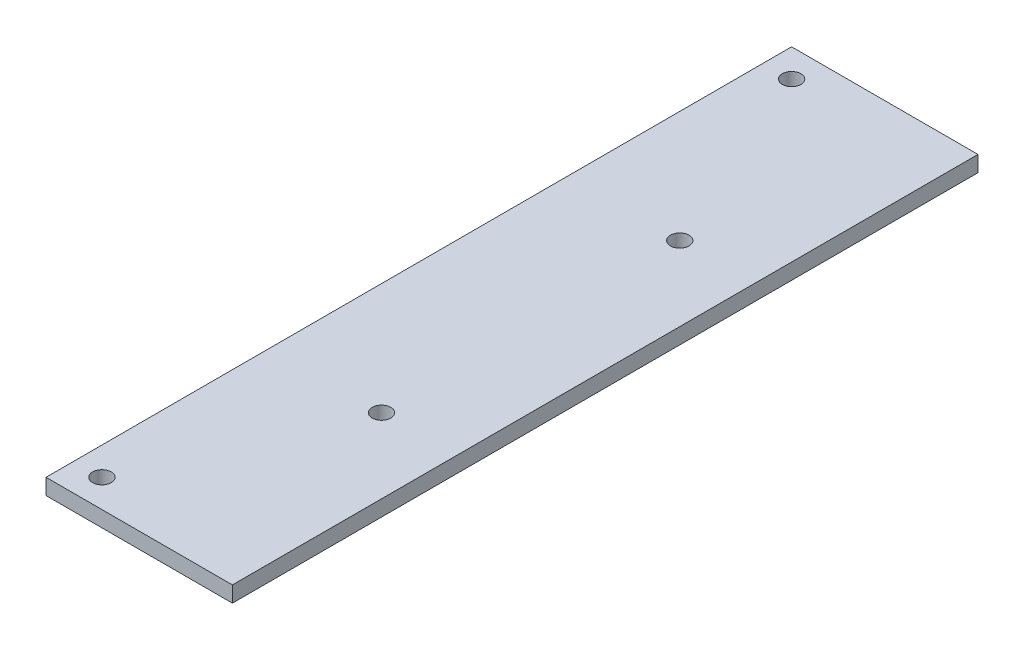
from build123d import *

# Parameters (mm, degrees)
SKETCH_1_W      = 20
SKETCH_1_H      = 80
SKETCH_1_R      = 1
EXTRUDE_1_DEPTH = 1.7
SKETCH_3_W      = 5.4
SKETCH_3_H      = 11.2
EXTRUDE_2_DEPTH = 2


with BuildPart() as part:
    # 草图1 → 凸台-拉伸1 (new body)
    with BuildSketch(Plane(origin=(0, 0, 0), x_dir=(1, 0, 0), z_dir=(0, 1, 0))):
        Rectangle(SKETCH_1_W, SKETCH_1_H)
        with Locations(Location((2, 16, 0), (0, 0, 270))):
            Circle(SKETCH_1_R, mode=Mode.SUBTRACT)
        with Locations(Location((2, -16, 0), (0, 0, 270))):
            Circle(SKETCH_1_R, mode=Mode.SUBTRACT)
        with Locations(Location((-7, 37, 0), (0, 0, 270))):
            Circle(SKETCH_1_R, mode=Mode.SUBTRACT)
        with Locations(Location((-7, -37, 0), (0, 0, 270))):
            Circle(SKETCH_1_R, mode=Mode.SUBTRACT)
    extrude(amount=EXTRUDE_1_DEPTH)

    # 草图3 → 凸台-拉伸2 (add)
    with BuildSketch(Plane.XZ):
        with Locations((-7.3, 0)):
            Rectangle(SKETCH_3_W, SKETCH_3_H)
    extrude(amount=EXTRUDE_2_DEPTH)


solid = part.part
